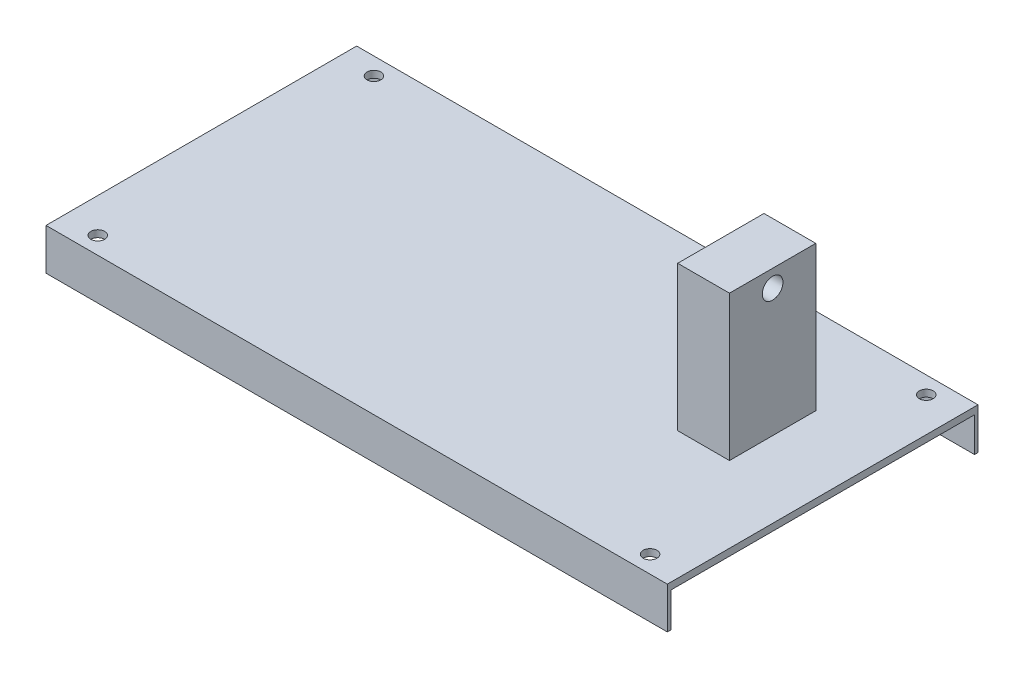
from build123d import *

# Parameters (mm, degrees)
IZIM1_W                     = 180
IZIM1_H                     = 90
Y_KSEKLIK_EKSTR_ZYON1_DEPTH = 2
IZIM2_W                     = 180
IZIM2_H                     = 1
Y_KSEKLIK_EKSTR_ZYON2_DEPTH = 10
IZIM3_R                     = 2
KES_EKSTR_ZYON1_DEPTH       = 10
IZIM6_W                     = 15
IZIM6_H                     = 25
Y_KSEKLIK_EKSTR_ZYON3_DEPTH = 42
IZIM7_R                     = 3
KES_EKSTR_ZYON2_DEPTH       = 49


with BuildPart() as part:
    # Çizim1 → Yükseklik-Ekstrüzyon1 (new body)
    with BuildSketch(Plane(origin=(0, 0, 0), x_dir=(1, 0, 0), z_dir=(0, 1, 0))):
        Rectangle(IZIM1_W, IZIM1_H)
    extrude(amount=Y_KSEKLIK_EKSTR_ZYON1_DEPTH)

    # Çizim2 → Yükseklik-Ekstrüzyon2 (add)
    with BuildSketch(Plane.XZ):
        with Locations((0, 44.5)):
            Rectangle(IZIM2_W, IZIM2_H)
    y_kseklik_ekstr_zyon2 = extrude(amount=Y_KSEKLIK_EKSTR_ZYON2_DEPTH)

    # Aynalama1: Yükseklik-Ekstrüzyon2 across plane
    add(y_kseklik_ekstr_zyon2.mirror(Plane.XY))

    # Çizim3 → Kes-Ekstrüzyon1 (cut)
    with BuildSketch(Plane.XZ):
        with Locations(Location((-80, 40, 0), (0, 0, 270))):
            Circle(IZIM3_R)
        with Locations(Location((-80, -40, 0), (0, 0, 270))):
            Circle(IZIM3_R)
    kes_ekstr_zyon1 = extrude(amount=-KES_EKSTR_ZYON1_DEPTH, mode=Mode.SUBTRACT)

    # Aynalama2: Kes-Ekstrüzyon1 across plane
    add(kes_ekstr_zyon1.mirror(Plane(origin=(0, 0, 0), x_dir=(0, 0, 1), z_dir=(1, 0, 0))), mode=Mode.SUBTRACT)

    # Çizim6 → Yükseklik-Ekstrüzyon3 (add)
    with BuildSketch(Plane(origin=(0, 2, 0), x_dir=(1, 0, 0), z_dir=(0, 1, 0))):
        with Locations((60.5, 7.5)):
            Rectangle(IZIM6_W, IZIM6_H)
    extrude(amount=Y_KSEKLIK_EKSTR_ZYON3_DEPTH)

    # Çizim7 → Kes-Ekstrüzyon2 (cut)
    with BuildSketch(Plane.ZY.offset(-53)):
        with Locations((-7.5, 39)):
            Circle(IZIM7_R)
    extrude(amount=-KES_EKSTR_ZYON2_DEPTH, mode=Mode.SUBTRACT)


solid = part.part
